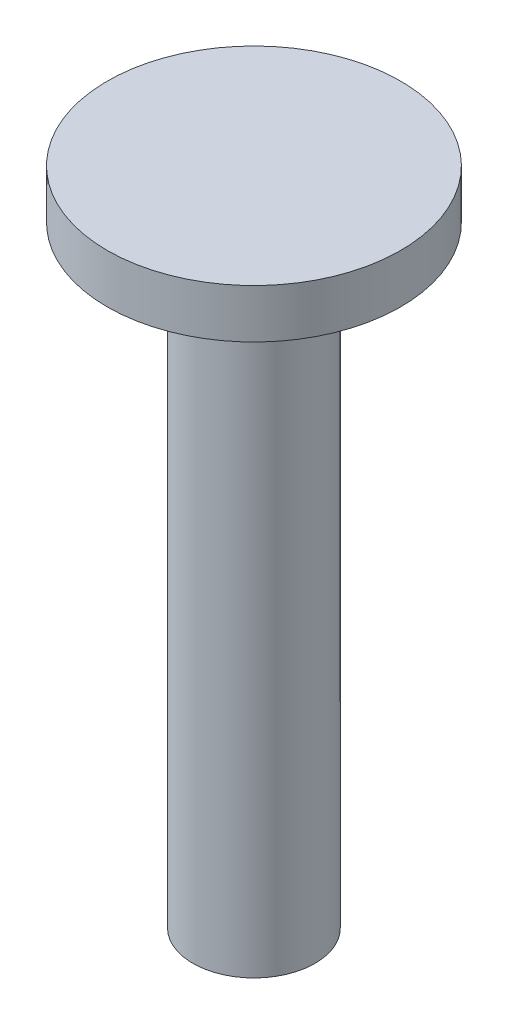
from build123d import *

# Parameters (mm, degrees)
SKETCH_1_R      = 2.4
EXTRUDE_1_DEPTH = 0.8
SKETCH_2_R      = 1
EXTRUDE_2_DEPTH = 10


with BuildPart() as part:
    # 草图1 → 凸台-拉伸1 (new body)
    with BuildSketch(Plane(origin=(0, 0, 0), x_dir=(1, 0, 0), z_dir=(0, 1, 0))):
        with Locations(Location((0, 0, 0), (0, 0, 270))):
            Circle(SKETCH_1_R)
    extrude(amount=EXTRUDE_1_DEPTH)

    # 草图2 → 凸台-拉伸2 (add)
    with BuildSketch(Plane.XZ):
        with Locations(Location((0, 0, 0), (0, 0, 270))):
            Circle(SKETCH_2_R)
    extrude(amount=EXTRUDE_2_DEPTH)


solid = part.part
